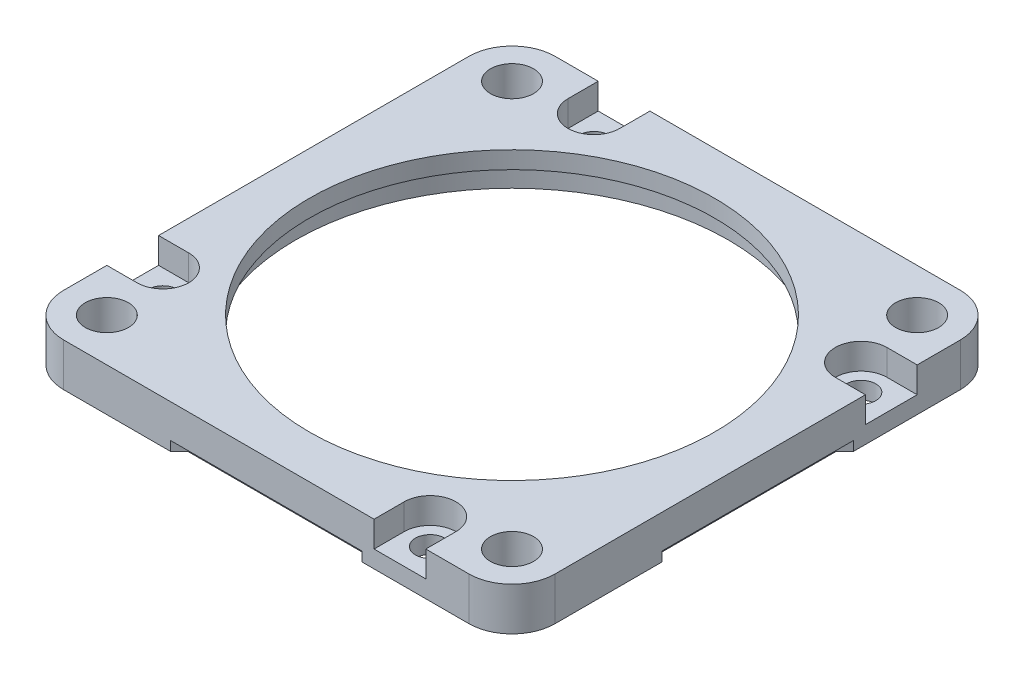
from build123d import *

# Parameters (mm, degrees)
SKETCH_1_W               = 57
SKETCH_1_H               = 57
EXTRUDE_1_DEPTH          = 5
SKETCH_2_R               = 23.5
CUT_EXTRUDE_1_DEPTH      = 2
SKETCH_3_R               = 25.1
CUT_EXTRUDE_2_DEPTH      = 3
SKETCH_4_R               = 2.5
SKETCH_4_R_2             = 1.7
CUT_EXTRUDE_3_DEPTH      = 41.614036982
CUT_EXTRUDE_4_DEPTH      = 3
CUT_EXTRUDE_5_DEPTH      = 1.1
PATTERN_CIRCULAR_1_COUNT = 4
FILLET_1_R               = 5


with BuildPart() as part:
    # 草图1 → 凸台-拉伸1 (new body)
    with BuildSketch(Plane(origin=(0, 0, 0), x_dir=(1, 0, 0), z_dir=(0, 1, 0))):
        Rectangle(SKETCH_1_W, SKETCH_1_H)
    extrude(amount=EXTRUDE_1_DEPTH)

    # 草图2 → 切除-拉伸1 (cut)
    with BuildSketch(Plane(origin=(0, 5, 0), x_dir=(1, 0, 0), z_dir=(0, 1, 0))):
        with Locations(Location((0, 0, 0), (0, 0, 270))):
            Circle(SKETCH_2_R)
    extrude(amount=-CUT_EXTRUDE_1_DEPTH, mode=Mode.SUBTRACT)

    # 草图3 → 切除-拉伸2 (cut)
    with BuildSketch(Plane(origin=(0, 3, 0), x_dir=(1, 0, 0), z_dir=(0, 1, 0))):
        with Locations(Location((0, 0, 0), (0, 0, 270))):
            Circle(SKETCH_3_R)
    extrude(amount=-CUT_EXTRUDE_2_DEPTH, mode=Mode.SUBTRACT)

    # 草图4 → 切除-拉伸3 (cut, through all)
    with BuildSketch(Plane(origin=(0, 5, 0), x_dir=(1, 0, 0), z_dir=(0, 1, 0))):
        with Locations(Location((-23.5, 23.5, 0), (0, 0, 270))):
            Circle(SKETCH_4_R)
        with Locations(Location((-15.5, 25, 0), (0, 0, 270))):
            Circle(SKETCH_4_R_2)
    cut_extrude_3 = extrude(amount=-CUT_EXTRUDE_3_DEPTH, mode=Mode.SUBTRACT)

    # 草图5 → 切除-拉伸4 (cut)
    with BuildSketch(Plane(origin=(0, 5, 0), x_dir=(1, 0, 0), z_dir=(0, 1, 0))):
        with BuildLine():
            Line((-18.5, 25), (-18.5, 30.780907879))
            ThreePointArc((-18.5, 30.780907879), (-15.5, 33.780907879), (-12.5, 30.780907879))
            Line((-12.5, 30.780907879), (-12.5, 25))
            ThreePointArc((-12.5, 25), (-15.5, 22), (-18.5, 25))
        make_face()
    cut_extrude_4 = extrude(amount=-CUT_EXTRUDE_4_DEPTH, mode=Mode.SUBTRACT)

    # 草图6 → 切除-拉伸5 (cut)
    with BuildSketch(Plane.XZ):
        Polygon((-28.5, 11.1), (-28.5, -11.1), (-27.5, -10.1), (-27.5, 10.1), align=None)
    cut_extrude_5 = extrude(amount=-CUT_EXTRUDE_5_DEPTH, mode=Mode.SUBTRACT)

    # 阵列(圆周)1: 切除-拉伸3, 切除-拉伸4, 切除-拉伸5 ×4 about axis
    pattern_circular_1_axis = Axis((0, 0, 0), (0, 1, 0))
    add([cut_extrude_3.rotate(pattern_circular_1_axis, i * 360 / PATTERN_CIRCULAR_1_COUNT) for i in range(1, PATTERN_CIRCULAR_1_COUNT)], mode=Mode.SUBTRACT)
    add([cut_extrude_4.rotate(pattern_circular_1_axis, i * 360 / PATTERN_CIRCULAR_1_COUNT) for i in range(1, PATTERN_CIRCULAR_1_COUNT)], mode=Mode.SUBTRACT)
    add([cut_extrude_5.rotate(pattern_circular_1_axis, i * 360 / PATTERN_CIRCULAR_1_COUNT) for i in range(1, PATTERN_CIRCULAR_1_COUNT)], mode=Mode.SUBTRACT)

    # 圆角1
    fillet_1_edges = [part.edges().sort_by_distance(p)[0] for p in [
        (28.5, 2.5, 28.5),
        (-28.5, 2.5, 28.5),
        (-28.5, 2.5, -28.5),
        (28.5, 2.5, -28.5),
    ]]
    fillet(fillet_1_edges, radius=FILLET_1_R)


solid = part.part
